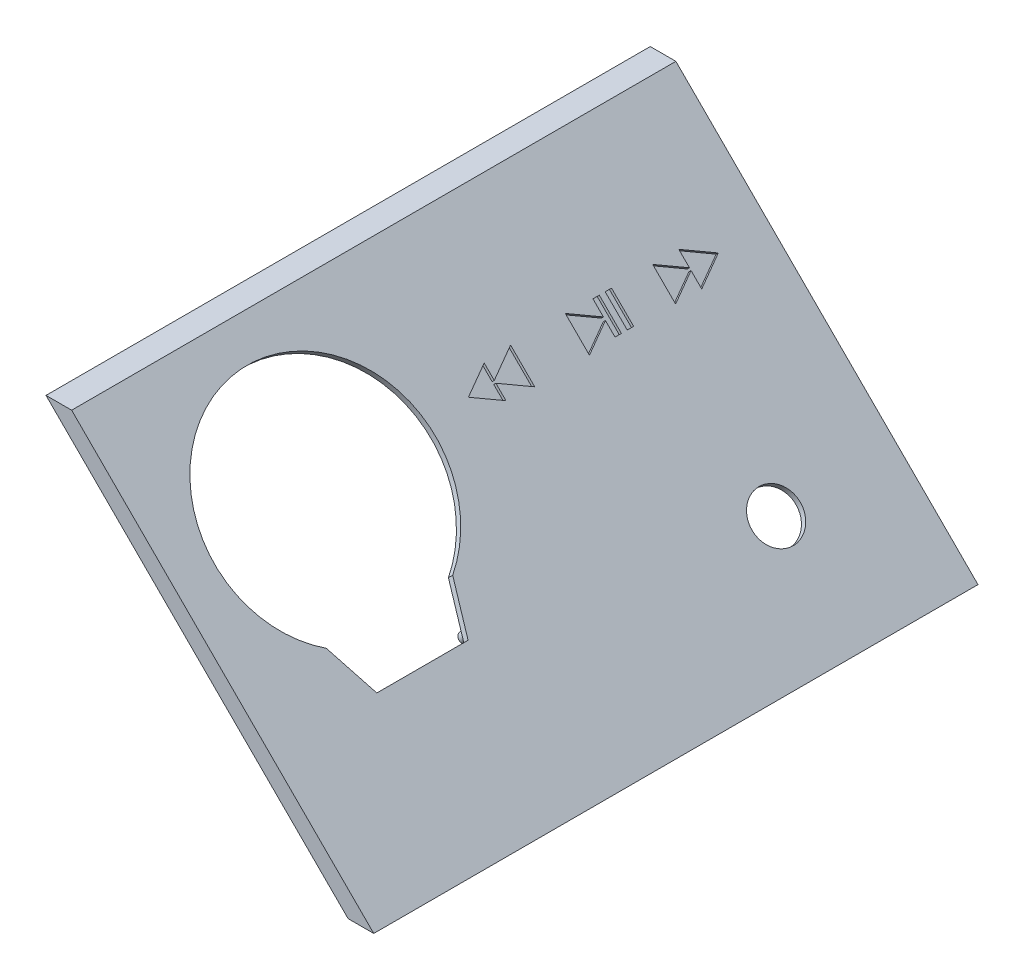
from build123d import *

# Parameters (mm, degrees)
BOSS_EXTRUDE1_DEPTH = 50
CUT_EXTRUDE1_DEPTH  = 10
SKETCH3_R           = 4
CUT_EXTRUDE2_DEPTH  = 10
SKETCH4_W           = 1.052304973
SKETCH4_H           = 5.165860775
CUT_EXTRUDE6_DEPTH  = 0.5
CUT_EXTRUDE7_DEPTH  = 2
SKETCH6_R           = 0.804992829
SKETCH6_R_2         = 0.803708801
BOSS_EXTRUDE2_DEPTH = 3


with BuildPart() as part:
    # Sketch1 → Boss-Extrude1 (new, symmetric)
    with BuildSketch(Plane.XY):
        Polygon((0, 0), (4.242640687, 0), (-45.757359313, 50), (-50, 50), align=None)
    extrude(amount=BOSS_EXTRUDE1_DEPTH, both=True)

    # Sketch2 → Cut-Extrude1 (cut)
    with BuildSketch(Plane(origin=(2.121320344, 2.121320344, 0), x_dir=(0, 0, -1), z_dir=(0.7071067811865487, 0.7071067811865465, 0))):
        with BuildLine():
            Line((-32.383146044, 21.19659939), (-17.279022802, 21.19659939))
            Line((-17.279022802, 21.19659939), (-14.530403118, 28.687350871))
            ThreePointArc((-14.530403118, 28.687350871), (-25.009728549, 61.996596804), (-35.453632693, 28.676227773))
            Line((-35.453632693, 28.676227773), (-32.383146044, 21.19659939))
        make_face()
    extrude(amount=-CUT_EXTRUDE1_DEPTH, mode=Mode.SUBTRACT)

    # Sketch3 → Cut-Extrude2 (cut)
    with BuildSketch(Plane(origin=(2.121320344, 2.121320344, 0), x_dir=(0, 0, -1), z_dir=(0.7071067811865487, 0.7071067811865465, 0))):
        with Locations(Location((29.848579643, 15.751722073, 0), (0, 0, 90))):
            Circle(SKETCH3_R)
    extrude(amount=-CUT_EXTRUDE2_DEPTH, mode=Mode.SUBTRACT)

    # Sketch4 → Cut-Extrude6 (cut)
    with BuildSketch(Plane(origin=(2.121320344, 2.121320344, 0), x_dir=(0, 0, -1), z_dir=(0.7071067811865488, 0.7071067811865462, 0))):
        Polygon((18.209716016, 48.632673253), (18.209716016, 42.984750661), (23.10096046, 45.808711957), align=None)
        with Locations((23.211533522, 45.906886197)):
            Rectangle(SKETCH4_W, SKETCH4_H)
        with Locations((25.236963378, 45.906886197)):
            Rectangle(SKETCH4_W, SKETCH4_H)
        Polygon((32.568799155, 48.489816584), (32.568799155, 43.12760733), (37.212608589, 45.808711957), align=None)
        Polygon((36.890986923, 48.489816584), (36.890986923, 43.12760733), (41.534796358, 45.808711957), align=None)
        Polygon((9.151606642, 48.632673253), (9.151606642, 42.984750661), (4.260362198, 45.808711957), align=None)
        Polygon((4.590275544, 48.355357963), (4.590275544, 43.262065951), (0.179355272, 45.808711957), align=None)
    extrude(amount=-CUT_EXTRUDE6_DEPTH, mode=Mode.SUBTRACT)

    # Sketch5 → Cut-Extrude7 (cut)
    with BuildSketch(Plane(origin=(0, 0, 0), x_dir=(0, 0, 1), z_dir=(-0.7071067811865488, -0.7071067811865462, 0))):
        Polygon((46.201031171, 64.525111683), (46.201031171, 13.41528861), (3.998852775, 13.41528861), (3.998852775, 2.899934094), (-43.862101498, 2.899934094), (-43.862101498, 38.281153906), (-43.862101498, 54.027620673), (3.998852775, 54.027620673), (3.998852775, 64.525111683), align=None)
    extrude(amount=-CUT_EXTRUDE7_DEPTH, mode=Mode.SUBTRACT)

    # Sketch6 → Boss-Extrude2 (add)
    with BuildSketch(Plane(origin=(2.121320344, 2.121320344, 0), x_dir=(0, 0, -1), z_dir=(0.7071067811865488, 0.7071067811865462, 0))):
        with Locations(Location((-34.35, 21.73, 0), (0, 0, 90))):
            Circle(SKETCH6_R)
        with Locations(Location((-15.49, 21.73, 0), (0, 0, 90))):
            Circle(SKETCH6_R_2)
    extrude(amount=-BOSS_EXTRUDE2_DEPTH)


solid = part.part
